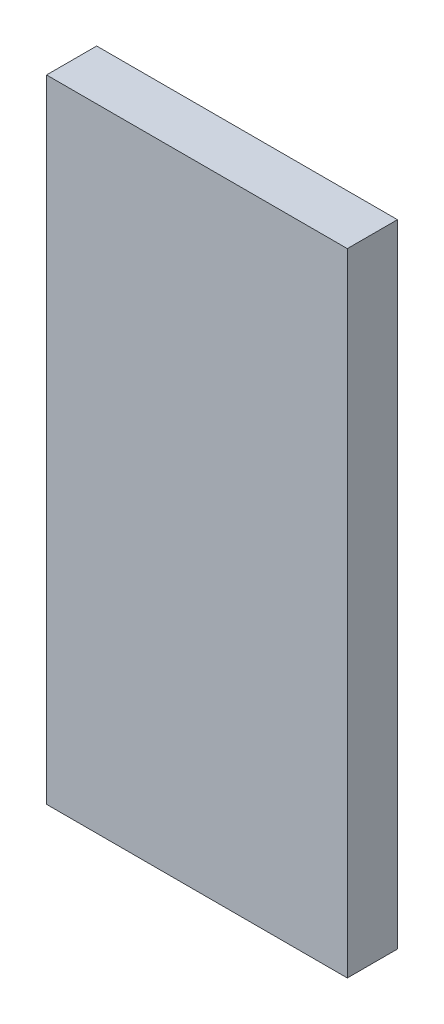
from build123d import *

# Parameters (mm, degrees)
SKETCH1_W           = 30
SKETCH1_H           = 63
BOSS_EXTRUDE1_DEPTH = 5


with BuildPart() as part:
    # Sketch1 → Boss-Extrude1 (new body)
    with BuildSketch(Plane.XY):
        with Locations((-13.030570538, 9.207067027)):
            Rectangle(SKETCH1_W, SKETCH1_H)
    extrude(amount=BOSS_EXTRUDE1_DEPTH)


solid = part.part
